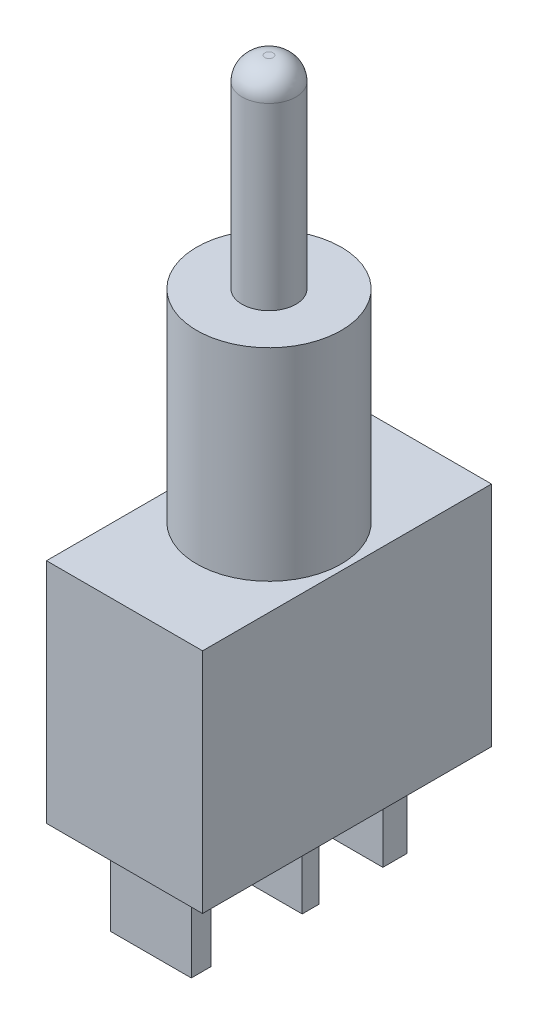
from build123d import *

# Parameters (mm, degrees)
SKETCH1_W           = 6.86
SKETCH1_H           = 12.7
BOSS_EXTRUDE1_DEPTH = 10
SKETCH2_W           = 3.547875369
SKETCH2_H           = 0.73404318
SKETCH2_H_2         = 0.876773798
SKETCH2_H_3         = 1.050089549
BOSS_EXTRUDE2_DEPTH = 4
SKETCH3_R           = 3.175
BOSS_EXTRUDE3_DEPTH = 8.89
SKETCH4_R           = 1.182295496
BOSS_EXTRUDE4_DEPTH = 8.89
FILLET1_R           = 1


with BuildPart() as part:
    # Sketch1 → Boss-Extrude1 (new body)
    with BuildSketch(Plane(origin=(0, 0, 0), x_dir=(1, 0, 0), z_dir=(0, 1, 0))):
        with Locations((3.43, 6.35)):
            Rectangle(SKETCH1_W, SKETCH1_H)
    extrude(amount=BOSS_EXTRUDE1_DEPTH)

    # Sketch2 → Boss-Extrude2 (add)
    with BuildSketch(Plane.XZ):
        with Locations((3.292366904, -6.538608317)):
            Rectangle(SKETCH2_W, SKETCH2_H)
        with Locations((3.292366904, -1.736742516)):
            Rectangle(SKETCH2_W, SKETCH2_H_2)
        with Locations((3.292366904, -10.244506871)):
            Rectangle(SKETCH2_W, SKETCH2_H_3)
    extrude(amount=BOSS_EXTRUDE2_DEPTH)

    # Sketch3 → Boss-Extrude3 (add)
    with BuildSketch(Plane(origin=(0, 10, 0), x_dir=(1, 0, 0), z_dir=(0, 1, 0))):
        with Locations(Location((3.43, 6.35, 0), (0, 0, 90))):
            Circle(SKETCH3_R)
    extrude(amount=BOSS_EXTRUDE3_DEPTH)

    # Sketch4 → Boss-Extrude4 (add)
    with BuildSketch(Plane(origin=(0, 18.89, 0), x_dir=(1, 0, 0), z_dir=(0, 1, 0))):
        with Locations(Location((3.43, 6.35, 0), (0, 0, 90))):
            Circle(SKETCH4_R)
    extrude(amount=BOSS_EXTRUDE4_DEPTH)

    # Fillet1
    fillet1_edges = [part.edges().sort_by_distance(p)[0] for p in [
        (3.43, 27.78, -5.167704504),
    ]]
    fillet(fillet1_edges, radius=FILLET1_R)


solid = part.part
